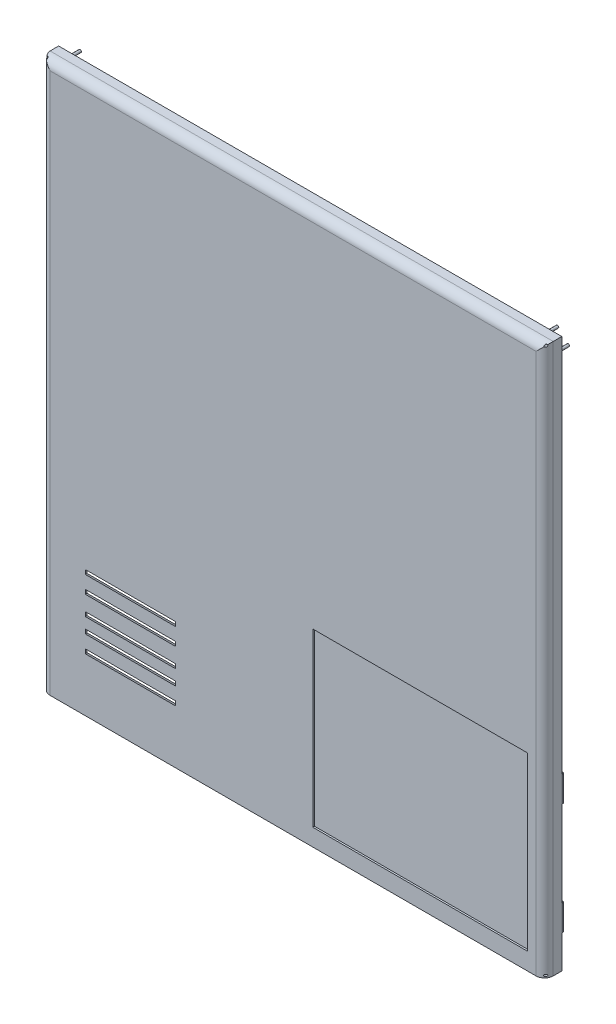
from build123d import *

# Parameters (mm, degrees)
SKETCH1_W                                           = 586
SKETCH1_H                                           = 640
SKETCH1_W_2                                         = 576
SKETCH1_H_2                                         = 630
BOSS_EXTRUDE1_DEPTH                                 = 20
FILLET1_R                                           = 10
SHELL1_T                                            = -5
SKETCH2_R                                           = 1.5
BOSS_EXTRUDE2_DEPTH                                 = 10
CSK_FOR_M2_COUNTERSUNK_FLAT_HEAD_SCREW1_D           = 2.4
CSK_FOR_M2_COUNTERSUNK_FLAT_HEAD_SCREW1_DEPTH       = 30
CSK_FOR_M2_COUNTERSUNK_FLAT_HEAD_SCREW1_CSINK_D     = 4.4
CSK_FOR_M2_COUNTERSUNK_FLAT_HEAD_SCREW1_CSINK_ANGLE = 90
CSK_FOR_M2_COUNTERSUNK_FLAT_HEAD_SCREW1_TIP         = 0.721032743
SKETCH5_W                                           = 250
SKETCH5_H                                           = 200
CUT_EXTRUDE1_DEPTH                                  = 10
CUT_EXTRUDE2_DEPTH                                  = 0.5
SKETCH6_3_W                                         = 250
SKETCH6_3_H                                         = 200
BOSS_EXTRUDE3_DEPTH                                 = 0.5
SKETCH7_R                                           = 1.5
CUT_EXTRUDE3_DEPTH                                  = 10
SKETCH8_W                                           = 4
SKETCH8_H                                           = 30
BOSS_EXTRUDE4_DEPTH                                 = 2.5
CUT_EXTRUDE5_DEPTH                                  = 178
CUT_EXTRUDE6_DEPTH                                  = 178
CUT_EXTRUDE7_START                                  = -10
SKETCH11_R                                          = 1.5
CUT_EXTRUDE7_DEPTH                                  = 10
SKETCH12_W                                          = 105
SKETCH12_H                                          = 5
CUT_EXTRUDE8_DEPTH                                  = 10
CUT_EXTRUDE8_TAPER                                  = -30


with BuildPart() as part:
    # Sketch1 → Boss-Extrude1 (new body)
    # profile 1 of 2: a face of its own
    with BuildSketch(Plane.XY):
        Rectangle(SKETCH1_W, SKETCH1_H)
        Rectangle(SKETCH1_W_2, SKETCH1_H_2, mode=Mode.SUBTRACT)
    # profile 2 of 2: a face of its own
    with BuildSketch(Plane.XY):
        Rectangle(SKETCH1_W_2, SKETCH1_H_2)
    extrude(amount=-BOSS_EXTRUDE1_DEPTH)

    # Fillet1
    fillet1_edges = [part.edges().sort_by_distance(p)[0] for p in [
        (-293, 0, 0),
        (0, 320, 0),
        (293, 0, 0),
    ]]
    fillet(fillet1_edges, radius=FILLET1_R)

    # Shell1
    shell1_openings = [part.faces().sort_by_distance(p)[0] for p in [
        (0, 0, -20),
    ]]
    offset(amount=SHELL1_T, openings=shell1_openings)

    # Sketch2 → Boss-Extrude2 (add)
    with BuildSketch(Plane(origin=(0, 0, -20), x_dir=(-1, 0, 0), z_dir=(0, 0, -1))):
        with Locations(Location((-290.5, 305, 0), (0, 0, 180))):
            Circle(SKETCH2_R)
        with Locations(Location((-278, 317.5, 0), (0, 0, 180))):
            Circle(SKETCH2_R)
        with Locations(Location((-290.5, -305, 0), (0, 0, 180))):
            Circle(SKETCH2_R)
        with BuildLine():
            ThreePointArc((290.5, 306.5), (289, 305), (290.5, 303.5))
            Line((290.5, 303.5), (290.5, 306.5))
        make_face()
        with BuildLine():
            Line((290.5, 306.5), (290.5, 303.5))
            ThreePointArc((290.5, 303.5), (291.560660172, 303.939339828), (292, 305))
            ThreePointArc((292, 305), (291.560660172, 306.060660172), (290.5, 306.5))
        make_face()
        with Locations((278, 317.5)):
            Circle(SKETCH2_R)
        with Locations(Location((290.5, -305, 0), (0, 0, 180))):
            Circle(SKETCH2_R)
    extrude(amount=BOSS_EXTRUDE2_DEPTH)

    # CSK for M2 Countersunk Flat Head Screw1
    with Locations(Plane.XY):
        with Locations((-290.5, 317.5), (290.5, 317.5), (290.5, -317.5), (-290.5, -317.5)):
            CounterSinkHole(CSK_FOR_M2_COUNTERSUNK_FLAT_HEAD_SCREW1_D / 2, CSK_FOR_M2_COUNTERSUNK_FLAT_HEAD_SCREW1_CSINK_D / 2, depth=CSK_FOR_M2_COUNTERSUNK_FLAT_HEAD_SCREW1_DEPTH, counter_sink_angle=CSK_FOR_M2_COUNTERSUNK_FLAT_HEAD_SCREW1_CSINK_ANGLE)
            with Locations((0, 0, -(CSK_FOR_M2_COUNTERSUNK_FLAT_HEAD_SCREW1_DEPTH + CSK_FOR_M2_COUNTERSUNK_FLAT_HEAD_SCREW1_TIP / 2))):  # 118° drill point
                Cone(0, CSK_FOR_M2_COUNTERSUNK_FLAT_HEAD_SCREW1_D / 2, CSK_FOR_M2_COUNTERSUNK_FLAT_HEAD_SCREW1_TIP, mode=Mode.SUBTRACT)

    # Sketch5 → Cut-Extrude1 (cut)
    with BuildSketch(Plane.XY):
        with Locations((148, -200)):
            Rectangle(SKETCH5_W, SKETCH5_H)
    extrude(amount=-CUT_EXTRUDE1_DEPTH, mode=Mode.SUBTRACT)

    # Sketch6 → Cut-Extrude2 (cut, symmetric)
    with BuildSketch(Plane.XY.offset(-2.5)):
        Polygon((21, -302), (273, -302), (273, -300), (23, -300), (23, -100), (273, -100), (273, -98), (21, -98), align=None)
    extrude(amount=CUT_EXTRUDE2_DEPTH, both=True, mode=Mode.SUBTRACT)

    # Sketch6<3> → Boss-Extrude3 (add, symmetric)
    with BuildSketch(Plane.XY.offset(-2.5)):
        with Locations((148, -200)):
            Rectangle(SKETCH6_3_W, SKETCH6_3_H)
        Polygon((21, -302), (273, -302), (273, -300), (23, -300), (23, -100), (273, -100), (273, -98), (21, -98), align=None)
    extrude(amount=BOSS_EXTRUDE3_DEPTH, both=True)

    # Sketch7 → Cut-Extrude3 (cut)
    with BuildSketch(Plane(origin=(0, 0, -20), x_dir=(-1, 0, 0), z_dir=(0, 0, -1))):
        with Locations((-289.5, -305)):
            Circle(SKETCH7_R)
    extrude(amount=CUT_EXTRUDE3_DEPTH, mode=Mode.SUBTRACT)

    # Sketch8 → Boss-Extrude4 (add, symmetric)
    with BuildSketch(Plane.ZY.offset(-290.5)):
        with Locations((-22, -137.5)):
            Rectangle(SKETCH8_W, SKETCH8_H)
        with Locations((-22, -267.5)):
            Rectangle(SKETCH8_W, SKETCH8_H)
    extrude(amount=BOSS_EXTRUDE4_DEPTH, both=True)

    # Sketch9 → Cut-Extrude5 (cut)
    with BuildSketch(Plane(origin=(0, -122.5, 0), x_dir=(1, 0, 0), z_dir=(0, 1, 0))):
        with BuildLine():
            ThreePointArc((289, 22), (290.5, 20.5), (292, 22))
            Line((292, 22), (289, 22))
        make_face()
        with BuildLine():
            Line((289, 22), (292, 22))
            ThreePointArc((292, 22), (290.5, 23.5), (289, 22))
        make_face()
    extrude(amount=-CUT_EXTRUDE5_DEPTH, mode=Mode.SUBTRACT)

    # Sketch10 → Cut-Extrude6 (cut)
    with BuildSketch(Plane(origin=(0, -122.5, 0), x_dir=(1, 0, 0), z_dir=(0, 1, 0))):
        with BuildLine():
            Line((288.75, 20), (288.75, 22))
            ThreePointArc((288.75, 22), (290.5, 23.75), (292.25, 22))
            Line((292.25, 22), (292.25, 20))
            Line((292.25, 20), (293, 20))
            Line((293, 20), (293, 24))
            Line((293, 24), (288, 24))
            Line((288, 24), (288, 20))
            Line((288, 20), (288.75, 20))
        make_face()
    extrude(amount=-CUT_EXTRUDE6_DEPTH, mode=Mode.SUBTRACT)

    # Sketch11 → Cut-Extrude7 (cut)
    with BuildSketch(Plane(origin=(0, 0, -30), x_dir=(-1, 0, 0), z_dir=(0, 0, -1)).offset(CUT_EXTRUDE7_START)):
        with Locations((-290.5, -305)):
            Circle(SKETCH11_R)
    extrude(amount=CUT_EXTRUDE7_DEPTH, mode=Mode.SUBTRACT)

    # Sketch12 → Cut-Extrude8 (cut)
    with BuildSketch(Plane.XY):
        with Locations((-189.5, -175)):
            Rectangle(SKETCH12_W, SKETCH12_H)
        with Locations((-189.5, -235)):
            Rectangle(SKETCH12_W, SKETCH12_H)
        with Locations((-189.5, -255)):
            Rectangle(SKETCH12_W, SKETCH12_H)
        with Locations((-189.5, -195)):
            Rectangle(SKETCH12_W, SKETCH12_H)
        with Locations((-189.5, -217.5)):
            Rectangle(SKETCH12_W, SKETCH12_H)
    extrude(amount=-CUT_EXTRUDE8_DEPTH, taper=CUT_EXTRUDE8_TAPER, mode=Mode.SUBTRACT)


solid = part.part
